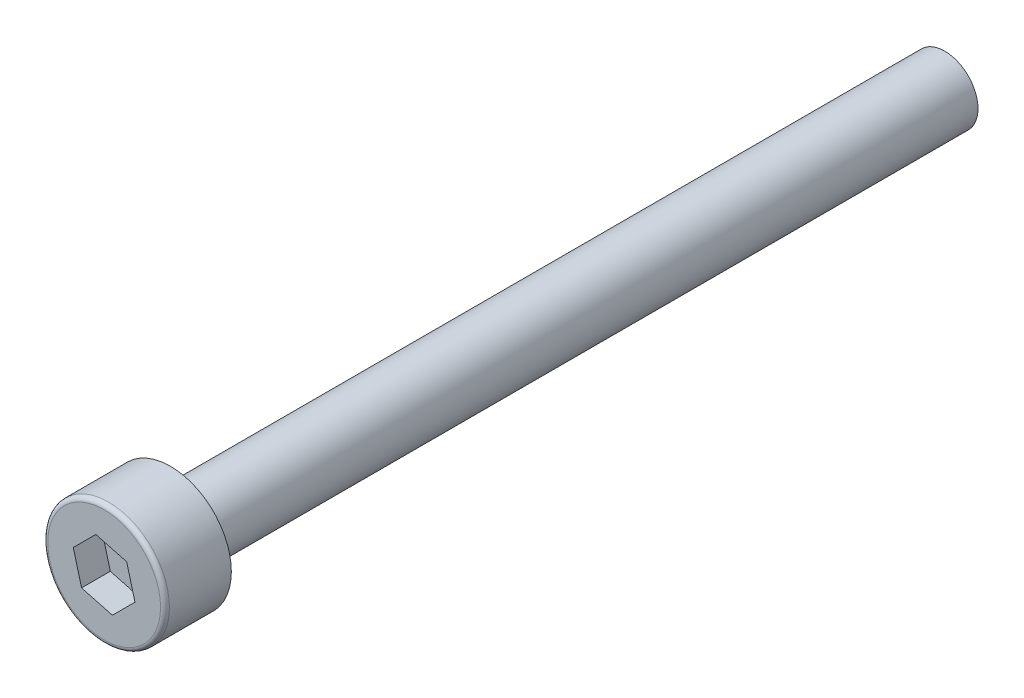
from build123d import *

# Parameters (mm, degrees)
SKETCH_1_R          = 2.75
EXTRUDE_1_DEPTH     = 3
CUT_EXTRUDE_1_DEPTH = 1.3
SKETCH_3_R          = 1.5
EXTRUDE_2_DEPTH     = 35
FILLET_1_R          = 0.2


with BuildPart() as part:
    # 草图1 → 凸台-拉伸1 (new body)
    with BuildSketch(Plane.XY):
        Circle(SKETCH_1_R)
    extrude(amount=EXTRUDE_1_DEPTH)

    # 草图2 → 切除-拉伸1 (cut)
    with BuildSketch(Plane.XY.offset(3)):
        Polygon((-1.020620726, -1.020620726), (0.373573113, -1.39419384), (1.39419384, -0.373573113), (1.020620726, 1.020620726), (-0.373573113, 1.39419384), (-1.39419384, 0.373573113), align=None)
    extrude(amount=-CUT_EXTRUDE_1_DEPTH, mode=Mode.SUBTRACT)

    # 草图3 → 凸台-拉伸2 (add)
    with BuildSketch(Plane(origin=(0, 0, 0), x_dir=(-1, 0, 0), z_dir=(0, 0, -1))):
        with Locations(Location((0, 0, 0), (0, 0, 180))):
            Circle(SKETCH_3_R)
    extrude(amount=EXTRUDE_2_DEPTH)

    # 圆角1
    fillet_1_edges = [part.edges().sort_by_distance(p)[0] for p in [
        (-2.75, 0, 3),
    ]]
    fillet(fillet_1_edges, radius=FILLET_1_R)


solid = part.part
